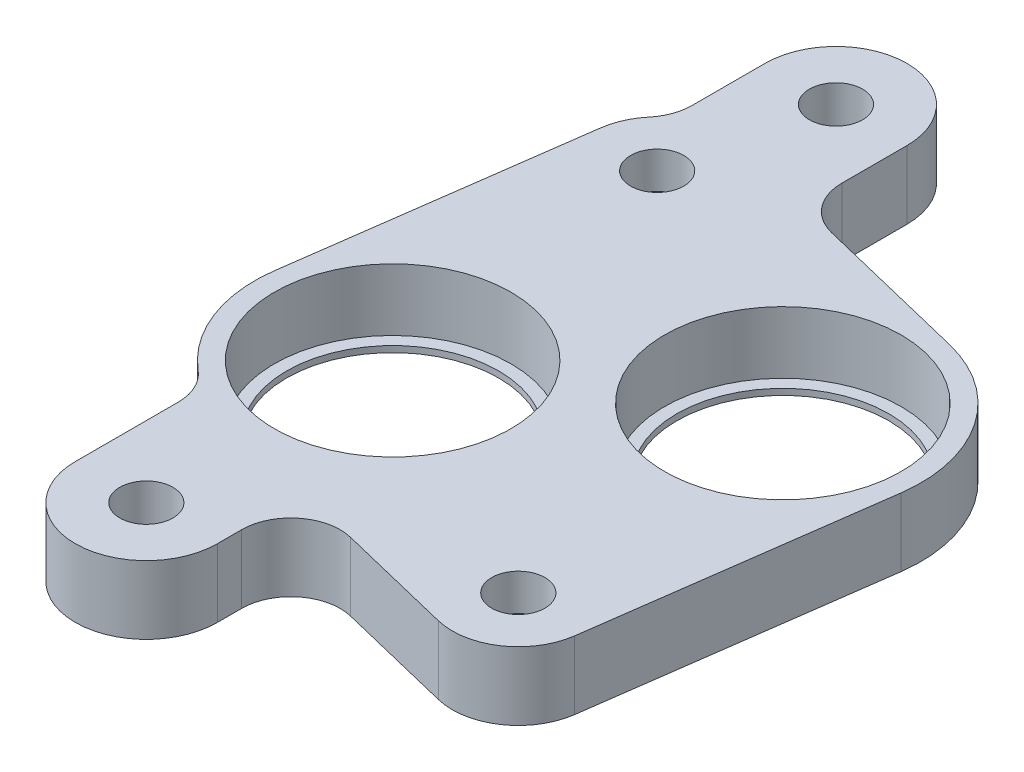
from build123d import *

# Parameters (mm, degrees)
SKETCH1_R           = 7.626999986
SKETCH1_R_2         = 1.7145
BOSS_EXTRUDE1_DEPTH = 4.000000128
BOSS_EXTRUDE2_START = 0.396875
SKETCH2_R           = 6.833249986
BOSS_EXTRUDE2_DEPTH = 0.396875
SKETCH3_R           = 2.794
CUT_EXTRUDE1_DEPTH  = 2.032
SKETCH6_R           = 1.7145
BOSS_EXTRUDE5_DEPTH = 4.396875128
FILLET1_R           = 3.175


with BuildPart() as part:
    # Sketch1 → Boss-Extrude1 (new body)
    with BuildSketch(Plane(origin=(0, 0, 0), x_dir=(-1, 0, 0), z_dir=(0, -1, 0))):
        with BuildLine():
            Line((-21.238527151, -9.504108586), (-23.776738447, 8.97469386))
            ThreePointArc((-23.776738447, 8.97469386), (-22.317172851, 15.191935329), (-17.068206789, 18.829623948))
            Line((-17.068206789, 18.829623948), (1.054165054, 23.244178876))
            ThreePointArc((1.054165054, 23.244178876), (4.455202947, 22.62752212), (6.276027151, 19.689508586))
            Line((6.276027151, 19.689508586), (8.814238447, 1.21070614))
            ThreePointArc((8.814238447, 1.21070614), (7.354672851, -5.006535329), (2.105706789, -8.644223948))
            Line((2.105706789, -8.644223948), (-16.016665054, -13.058778876))
            ThreePointArc((-16.016665054, -13.058778876), (-19.417702947, -12.44212212), (-21.238527151, -9.504108586))
        make_face()
        with Locations(Location((-14.9625, 10.1854, 0), (0, 0, 90))):
            Circle(SKETCH1_R, mode=Mode.SUBTRACT)
        with Locations(Location((0, 0, 0), (0, 0, 90))):
            Circle(SKETCH1_R, mode=Mode.SUBTRACT)
        with Locations(Location((2.061103297, 19.110555087, 0), (0, 0, 90))):
            Circle(SKETCH1_R_2, mode=Mode.SUBTRACT)
        with Locations(Location((-17.023603297, -8.925155087, 0), (0, 0, 90))):
            Circle(SKETCH1_R_2, mode=Mode.SUBTRACT)
    extrude(amount=-BOSS_EXTRUDE1_DEPTH)

    # Sketch2 → Boss-Extrude2 (add)
    with BuildSketch(Plane.XZ.offset(BOSS_EXTRUDE2_START)):
        with BuildLine():
            Line((16.016665054, 13.058778876), (-2.105706789, 8.644223948))
            ThreePointArc((-2.105706789, 8.644223948), (-7.354672851, 5.006535329), (-8.814238447, -1.21070614))
            Line((-8.814238447, -1.21070614), (-6.276027151, -19.689508586))
            ThreePointArc((-6.276027151, -19.689508586), (-4.455202947, -22.62752212), (-1.054165054, -23.244178876))
            Line((-1.054165054, -23.244178876), (17.068206789, -18.829623948))
            ThreePointArc((17.068206789, -18.829623948), (22.317172851, -15.191935329), (23.776738447, -8.97469386))
            Line((23.776738447, -8.97469386), (21.238527151, 9.504108586))
            ThreePointArc((21.238527151, 9.504108586), (19.417702947, 12.44212212), (16.016665054, 13.058778876))
        make_face()
        with Locations(Location((14.9625, -10.1854, 0), (0, 0, 270))):
            Circle(SKETCH2_R, mode=Mode.SUBTRACT)
        with Locations(Location((0, 0, 0), (0, 0, 270))):
            Circle(SKETCH2_R, mode=Mode.SUBTRACT)
    extrude(amount=-BOSS_EXTRUDE2_DEPTH)

    # Sketch3 → Cut-Extrude1 (cut)
    with BuildSketch(Plane.XZ.offset(0.396875)):
        with Locations(Location((17.023603297, 8.925155087, 0), (0, 0, 270))):
            Circle(SKETCH3_R)
        with Locations(Location((-2.061103297, -19.110555087, 0), (0, 0, 270))):
            Circle(SKETCH3_R)
    extrude(amount=-CUT_EXTRUDE1_DEPTH, mode=Mode.SUBTRACT)

    # Sketch6 → Boss-Extrude5 (add)
    # profile 1 of 2: a face of its own
    with BuildSketch(Plane.XZ.offset(0.396875)):
        with BuildLine():
            Line((-4.580991155, 7.626999986), (-4.580991155, 15.875))
            ThreePointArc((-4.580991155, 15.875), (0, 20.455991155), (4.580991155, 15.875))
            Line((4.580991155, 15.875), (4.580991155, 10.273083328))
            Line((4.580991155, 10.273083328), (-2.105706789, 8.644223948))
            ThreePointArc((-2.105706789, 8.644223948), (-3.381814379, 8.229212614), (-4.580991155, 7.626999986))
        make_face()
        with Locations(Location((0, 15.875, 0), (0, 0, 270))):
            Circle(SKETCH6_R, mode=Mode.SUBTRACT)
    # profile 2 of 2: a face of its own
    with BuildSketch(Plane.XZ.offset(0.396875)):
        with BuildLine():
            Line((-4.580991155, -22.538518831), (-4.580991155, -28.575))
            ThreePointArc((-4.580991155, -28.575), (0, -33.155991155), (4.580991155, -28.575))
            Line((4.580991155, -28.575), (4.580991155, -21.87147188))
            Line((4.580991155, -21.87147188), (-1.054165054, -23.244178876))
            ThreePointArc((-1.054165054, -23.244178876), (-2.89581472, -23.282368493), (-4.580991155, -22.538518831))
        make_face()
        with Locations(Location((0, -28.575, 0), (0, 0, 270))):
            Circle(SKETCH6_R, mode=Mode.SUBTRACT)
    extrude(amount=-BOSS_EXTRUDE5_DEPTH)

    # Fillet1
    fillet1_edges = [part.edges().sort_by_distance(p)[0] for p in [
        (4.580991155, 1.801562564, 10.273083328),
        (-4.580991155, 1.801562564, 7.626999986),
        (4.580991155, 1.801562564, -21.87147188),
        (-4.580991155, 1.801562564, -22.538518831),
    ]]
    fillet(fillet1_edges, radius=FILLET1_R)


solid = part.part
